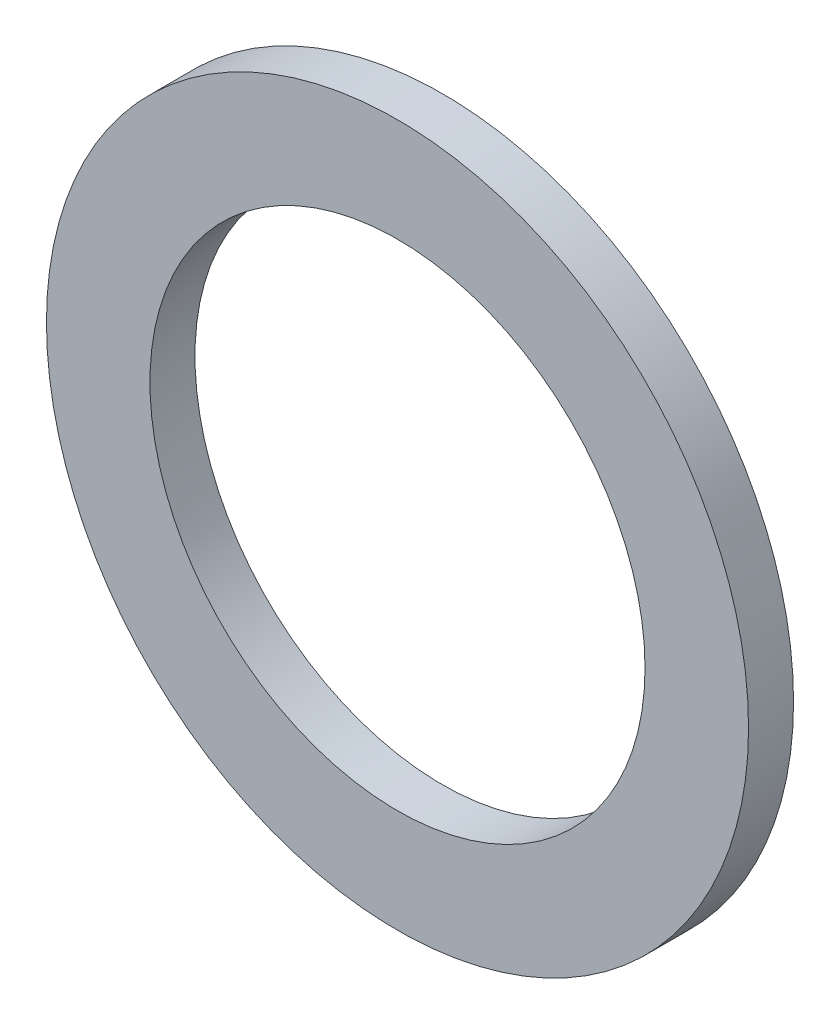
from build123d import *

# Parameters (mm, degrees)
SKETCH_1_R      = 39
SKETCH_1_R_2    = 27.5
EXTRUDE_1_DEPTH = 5


with BuildPart() as part:
    # 草图1 → 凸台-拉伸1 (new body)
    with BuildSketch(Plane.XY):
        Circle(SKETCH_1_R)
        Circle(SKETCH_1_R_2, mode=Mode.SUBTRACT)
    extrude(amount=EXTRUDE_1_DEPTH)


solid = part.part
